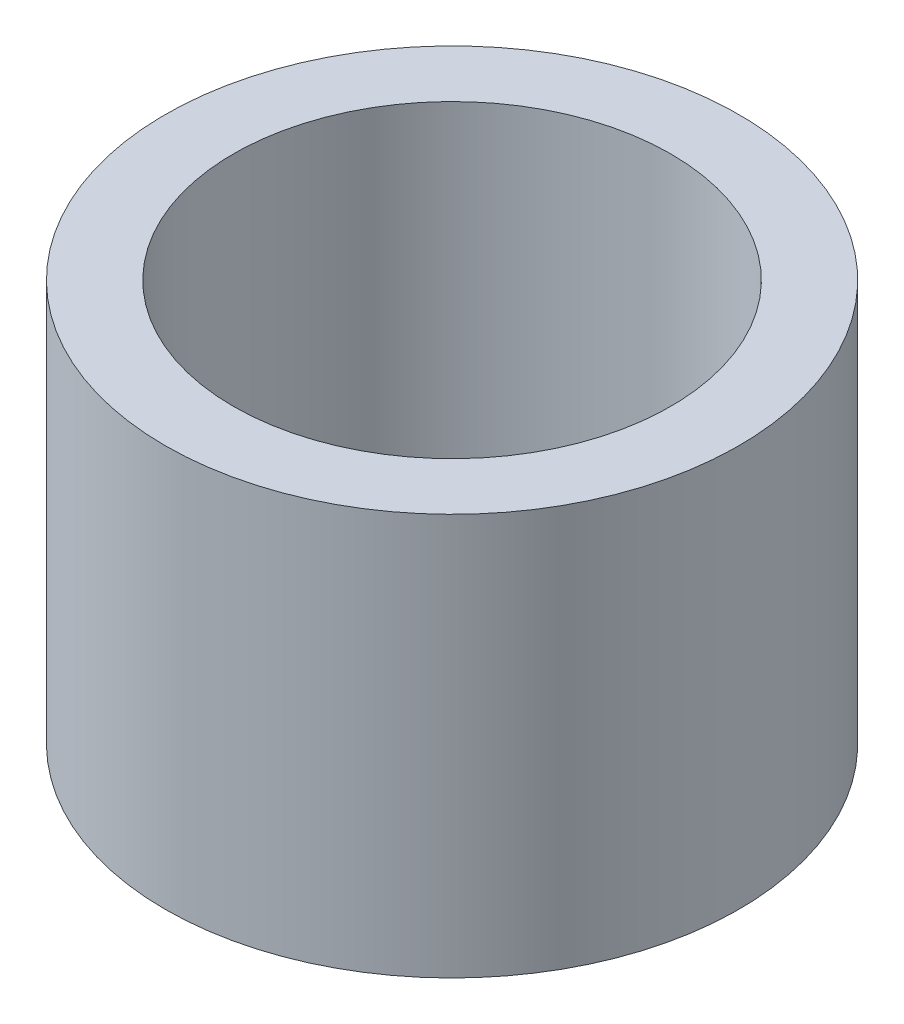
from build123d import *

# Parameters (mm, degrees)
SKETCH1_R           = 4
SKETCH1_R_2         = 3.05
BOSS_EXTRUDE1_DEPTH = 5.6


with BuildPart() as part:
    # Sketch1 → Boss-Extrude1 (new body)
    with BuildSketch(Plane(origin=(0, 0, 0), x_dir=(1, 0, 0), z_dir=(0, 1, 0))):
        with Locations(Location((0, 0, 0), (0, 0, 270))):
            Circle(SKETCH1_R)
        with Locations(Location((0, 0, 0), (0, 0, 270))):
            Circle(SKETCH1_R_2, mode=Mode.SUBTRACT)
    extrude(amount=BOSS_EXTRUDE1_DEPTH)


solid = part.part
